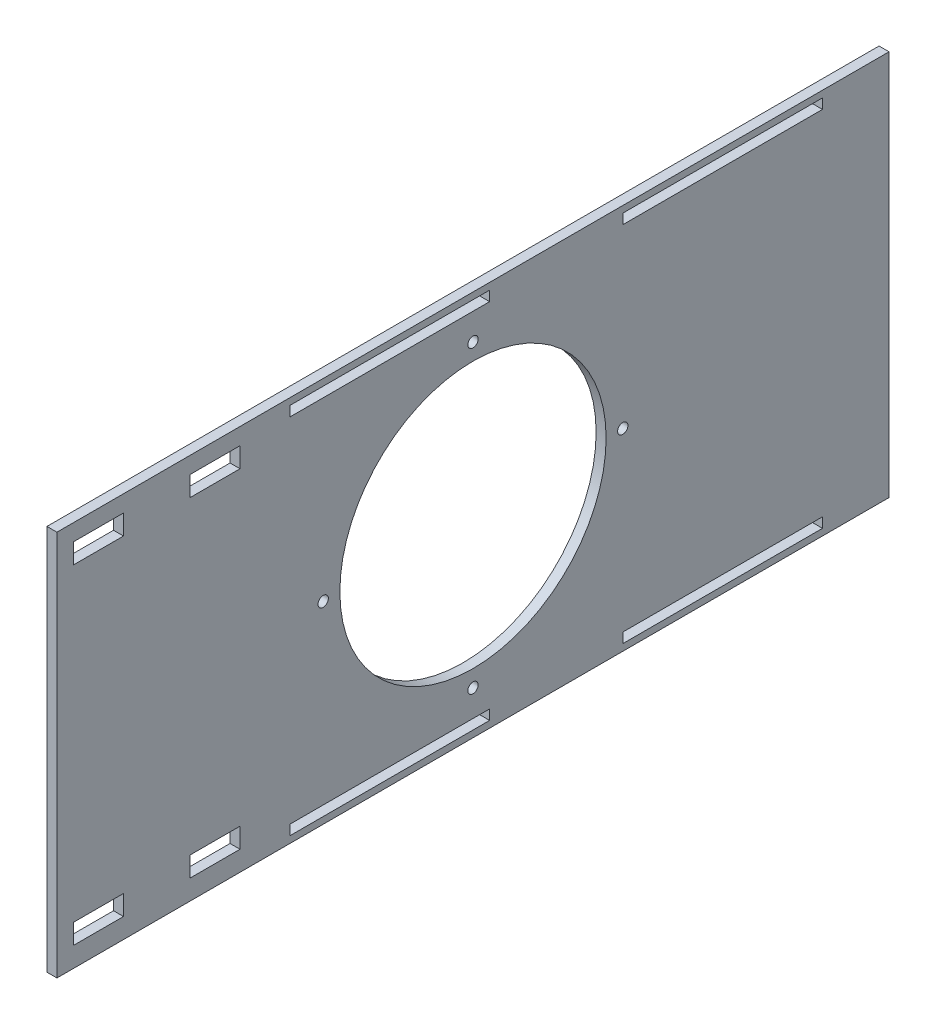
from build123d import *

# Parameters (mm, degrees)
ESQUISSE1_W        = 250
ESQUISSE1_H        = 116
ESQUISSE1_R        = 40
ESQUISSE1_R_2      = 1.55
ESQUISSE1_W_2      = 15
ESQUISSE1_H_2      = 6
ESQUISSE1_W_3      = 60
ESQUISSE1_H_3      = 3
BOSS_EXTRU_1_DEPTH = 3


with BuildPart() as part:
    # Esquisse1 → Boss.-Extru.1 (new body)
    with BuildSketch(Plane(origin=(0, 0, 0), x_dir=(0, 0, -1), z_dir=(1, 0, 0))):
        with Locations((125, 58)):
            Rectangle(ESQUISSE1_W, ESQUISSE1_H)
        with Locations((125, 58)):
            Circle(ESQUISSE1_R, mode=Mode.SUBTRACT)
        with Locations((125, 103)):
            Circle(ESQUISSE1_R_2, mode=Mode.SUBTRACT)
        with Locations((125, 13)):
            Circle(ESQUISSE1_R_2, mode=Mode.SUBTRACT)
        with Locations((80, 58)):
            Circle(ESQUISSE1_R_2, mode=Mode.SUBTRACT)
        with Locations((170, 58)):
            Circle(ESQUISSE1_R_2, mode=Mode.SUBTRACT)
        with Locations((12.5, 108)):
            Rectangle(ESQUISSE1_W_2, ESQUISSE1_H_2, mode=Mode.SUBTRACT)
        with Locations((12.5, 9)):
            Rectangle(ESQUISSE1_W_2, ESQUISSE1_H_2, mode=Mode.SUBTRACT)
        with Locations((47.5, 108)):
            Rectangle(ESQUISSE1_W_2, ESQUISSE1_H_2, mode=Mode.SUBTRACT)
        with Locations((47.5, 9)):
            Rectangle(ESQUISSE1_W_2, ESQUISSE1_H_2, mode=Mode.SUBTRACT)
        with Locations((100, 112.481116732)):
            Rectangle(ESQUISSE1_W_3, ESQUISSE1_H_3, mode=Mode.SUBTRACT)
        with Locations((200, 112.5)):
            Rectangle(ESQUISSE1_W_3, ESQUISSE1_H_3, mode=Mode.SUBTRACT)
        with Locations((100, 3.518883268)):
            Rectangle(ESQUISSE1_W_3, ESQUISSE1_H_3, mode=Mode.SUBTRACT)
        with Locations((200, 3.5)):
            Rectangle(ESQUISSE1_W_3, ESQUISSE1_H_3, mode=Mode.SUBTRACT)
    extrude(amount=BOSS_EXTRU_1_DEPTH)


solid = part.part
